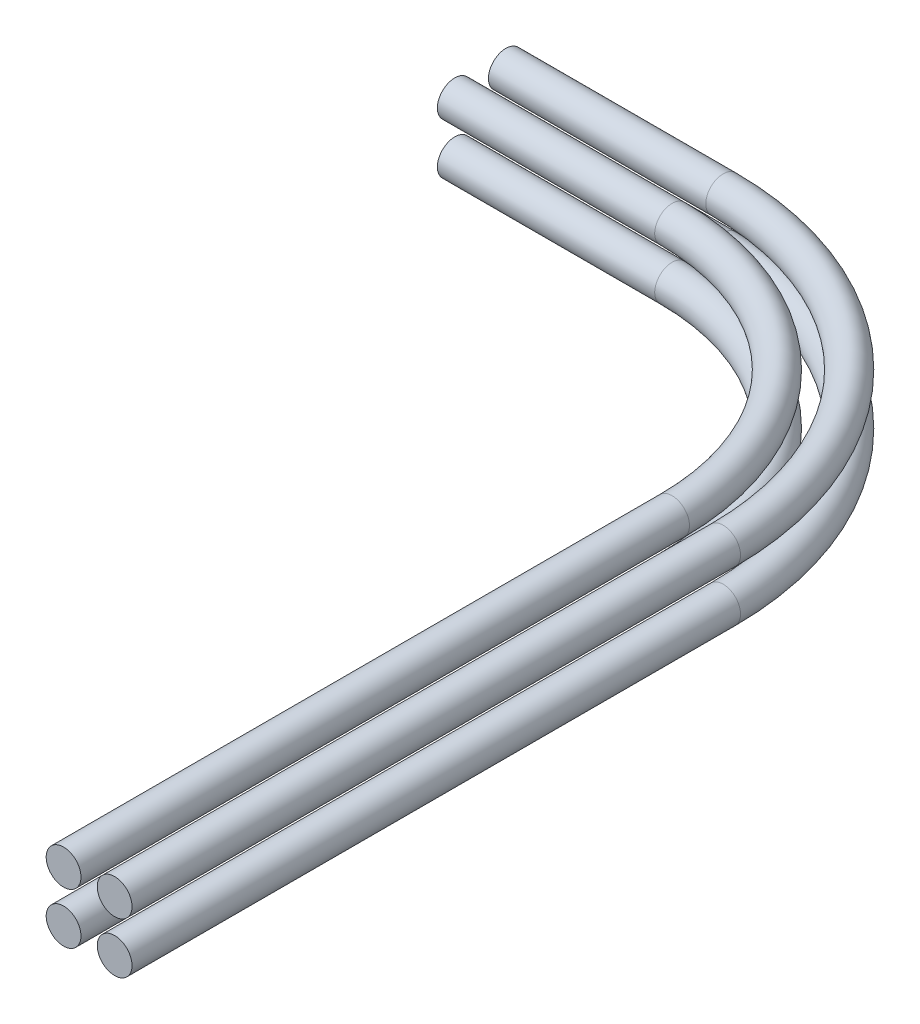
from build123d import *

# Parameters (mm, degrees)
SKETCH2_R       = 1.6
LPATTERN1_COUNT = 2
LPATTERN1_PITCH = 4.7


with BuildPart() as part:
    # Sweep1: sweep along a path in Sketch1
    with BuildLine(Plane(origin=(0, 0, 0), x_dir=(1, 0, 0), z_dir=(0, 1, 0))) as sweep1_path:
        Line((0, 0), (20, 0))
        ThreePointArc((20, 0), (39.798989873, -8.201010127), (48, -28))
        Line((48, -28), (48, -84))
    # Sketch2 → Sweep1 (sweep)
    with BuildSketch(Plane(origin=(0, 0, 0), x_dir=(0, 0, -1), z_dir=(1, 0, 0))):
        Circle(SKETCH2_R)
        with Locations((-4.7, 0)):
            Circle(SKETCH2_R)
    sweep1 = sweep(path=sweep1_path.line)


with BuildPart() as lpattern1_1:
    # LPattern1: Sweep1 ×2
    with Locations(*[(0, i * LPATTERN1_PITCH, 0) for i in range(1, LPATTERN1_COUNT)]):
        add(sweep1)


solid = Compound([part.part, lpattern1_1.part])
